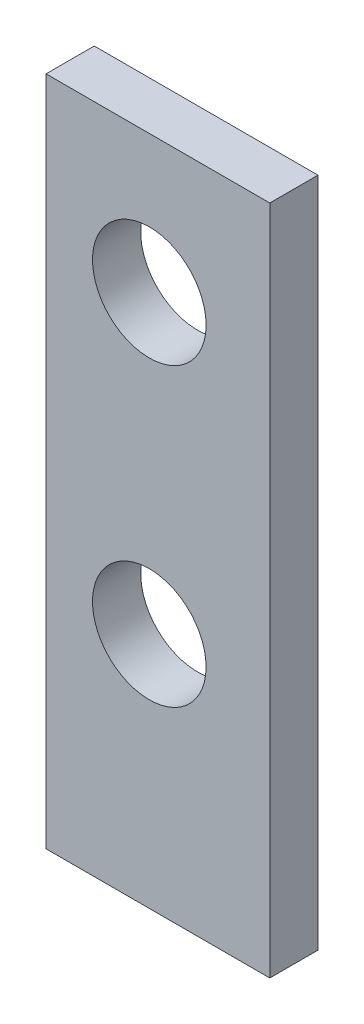
from build123d import *

# Parameters (mm, degrees)
SKETCH1_W           = 6.5
SKETCH1_H           = 19.5
SKETCH1_R           = 1.65
BOSS_EXTRUDE1_DEPTH = 1.4


with BuildPart() as part:
    # Sketch1 → Boss-Extrude1 (new body)
    with BuildSketch(Plane.XY):
        with Locations((-36.95, -61.15)):
            Rectangle(SKETCH1_W, SKETCH1_H)
        with Locations((-37.2, -64)):
            Circle(SKETCH1_R, mode=Mode.SUBTRACT)
        with Locations((-37.2, -55.4)):
            Circle(SKETCH1_R, mode=Mode.SUBTRACT)
    extrude(amount=BOSS_EXTRUDE1_DEPTH)


solid = part.part
